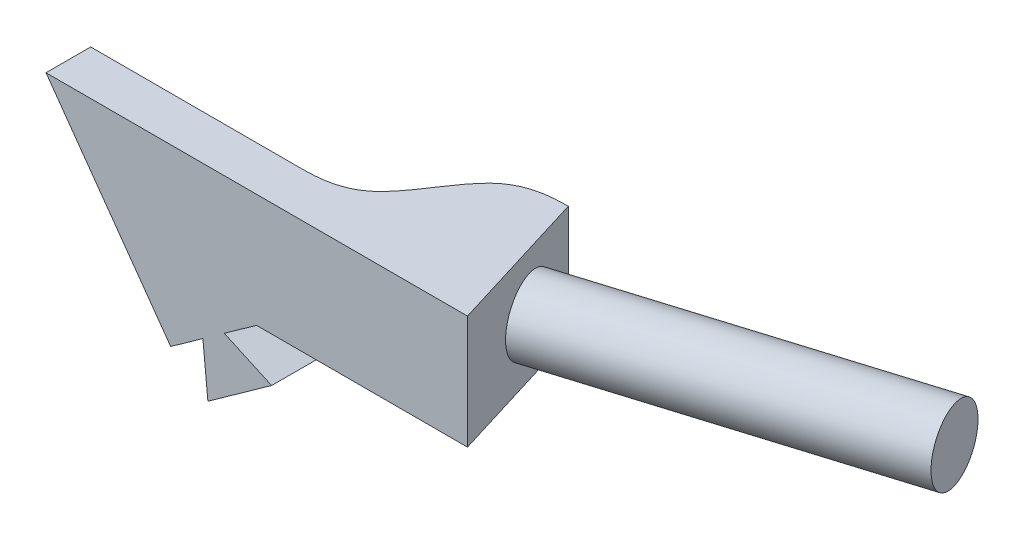
from build123d import *

# Parameters (mm, degrees)
BOSS_EXTRUDE1_DEPTH      = 12.7
BOSS_EXTRUDE1_DEPTH_BACK = 19.878167
SKETCH1_W                = 76.2
SKETCH1_H                = 25.4
CUT_EXTRUDE1_DEPTH       = 50.919049703
SKETCH4_R                = 7.9375
BOSS_EXTRUDE2_DEPTH      = 76.2
BOSS_EXTRUDE3_DEPTH      = 10


with BuildPart() as part:
    # Sketch1 → Boss-Extrude1 (new, two sides: drawn at the far end of the back side and taken through both)
    with BuildSketch(Plane.XY.offset(-BOSS_EXTRUDE1_DEPTH_BACK)):
        Rectangle(SKETCH1_W, SKETCH1_H)
    extrude(amount=BOSS_EXTRUDE1_DEPTH + BOSS_EXTRUDE1_DEPTH_BACK)

    # Sketch2 → Cut-Extrude1 (cut, through all)
    with BuildSketch(Plane.XZ.offset(12.7)):
        Polygon((33.097822487, -3.5890835), (28.095644974, -19.878167), (30.299971912, -19.878167), (38.1, -19.878167), (38.1, -5.125190787), align=None)
        Polygon((38.1, 12.7), (33.097822487, -3.5890835), (38.1, -5.125190787), align=None)
        with BuildLine():
            Line((28.095644974, -19.878167), (-38.1, -19.878167))
            Line((-38.1, -19.878167), (-38.1, 2.7))
            Line((-38.1, 2.7), (-9.105646135, 2.7))
            add(Edge.make_bspline(
                [(28.095644974, -19.878167), (23.262476233, -19.878167), (13.759725723, -18.38827049), (5.19295176, 1.21010349), (-4.185142014, 2.7), (-9.105646135, 2.7)],
                knots=[0, 0, 0, 0, 0.311689084, 0.688310916, 1, 1, 1, 1], degree=3))
        make_face()
    extrude(amount=-CUT_EXTRUDE1_DEPTH, mode=Mode.SUBTRACT)

    # Sketch4 → Boss-Extrude2 (add)
    with BuildSketch(Plane(origin=(31.252760971, 0, -9.59733911), x_dir=(-0.2935578385035089, 0, -0.95594131381228), z_dir=(0.95594131381228, 0, -0.2935578385035089))):
        with Locations((-2.530674188, 0)):
            Circle(SKETCH4_R)
    extrude(amount=BOSS_EXTRUDE2_DEPTH)

    # Sketch5 → Boss-Extrude3 (add)
    with BuildSketch(Plane(origin=(0, 0, 2.7), x_dir=(-1, 0, 0), z_dir=(0, 0, -1))):
        Polygon((9.105646135, -12.7), (28.322642206, -26.407350084), (38.1, -12.7), align=None)
        Polygon((38.1, -12.7), (56.217643925, 12.7), (38.1, 12.7), align=None)
        Polygon((16.319736518, -17.845760662), (21.108551823, -21.261589422), (19.992545993, -32.851753107), (5.724357418, -22.674353105), align=None)
    extrude(amount=-BOSS_EXTRUDE3_DEPTH)


solid = part.part
